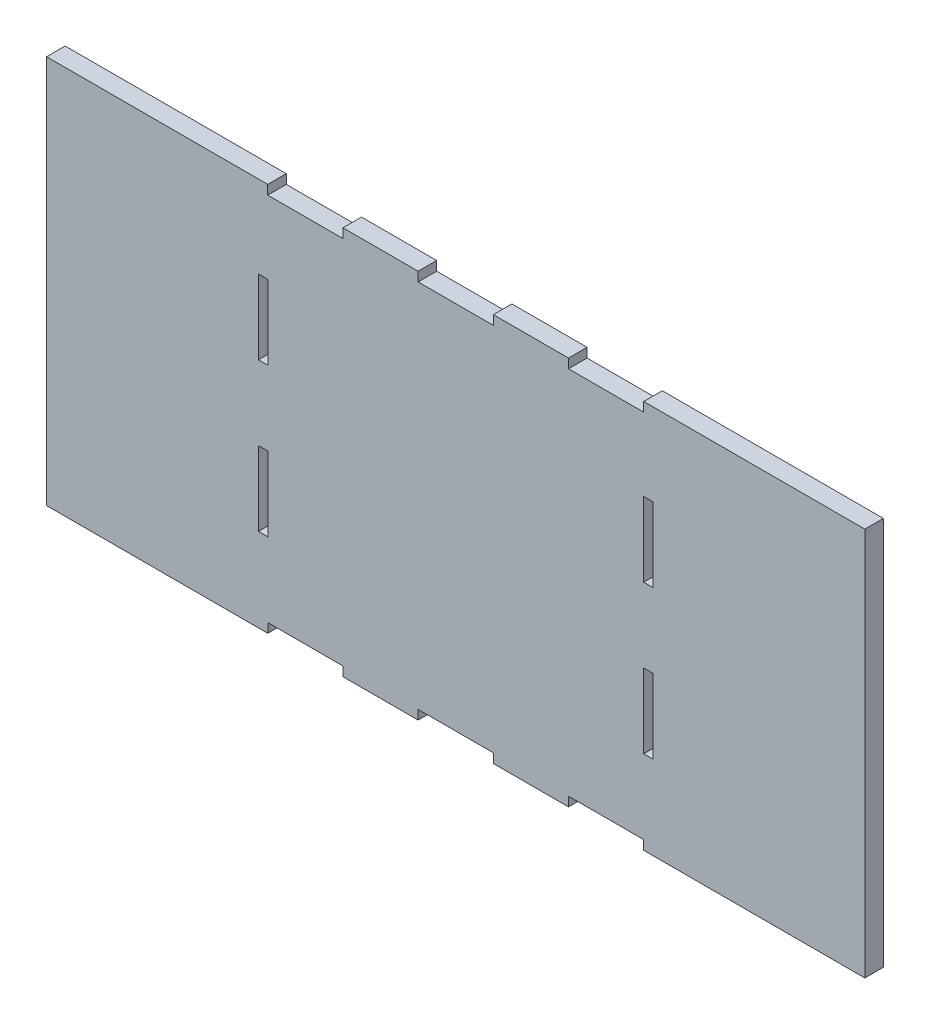
from build123d import *

# Parameters (mm, degrees)
BOSS_EXTRUDE1_DEPTH = 20.32
SKETCH2_W           = 10.166490401
SKETCH2_H           = 81.316938585
SKETCH2_W_2         = 10.166490402
SKETCH2_H_2         = 81.316938584
SKETCH2_W_3         = 82.271298803
SKETCH2_H_3         = 10.16
CUT_EXTRUDE2_DEPTH  = 137.414
CUT_EXTRUDE3_DEPTH  = 1426.288377921
SKETCH5_W           = 82.296
SKETCH5_H           = 10.16
CUT_EXTRUDE4_DEPTH  = 1408.889980636
CUT_EXTRUDE5_DEPTH  = 1408.889980636
SKETCH7_W           = 370.520147136
SKETCH7_H           = 597.78628448
SKETCH7_W_2         = 231.394598612
SKETCH7_H_2         = 493.59842382
CUT_EXTRUDE6_DEPTH  = 25.4


with BuildPart() as part:
    # Sketch1 → Boss-Extrude1 (new body)
    with BuildSketch(Plane.XY):
        with BuildLine():
            Line((0, 0), (1345.447057269, 0))
            Line((1345.447057269, 0), (1156.937235756, -454.288839135))
            add(Edge.make_bspline(
                [(1156.937235756, -454.288839135), (1155.965204773, -456.631331547), (1154.630956054, -458.816896883), (1152.225947859, -461.69350105), (1151.355065983, -462.590813772), (1149.473312624, -464.260936999), (1148.45987476, -465.033112958), (1146.360299176, -466.401155283), (1145.26635201, -467.004685932), (1142.990856866, -468.052074807), (1141.798989191, -468.498505895), (1138.174492983, -469.560599459), (1135.699262078, -469.911644948), (1133.16419506, -469.9)],
                knots=[0, 0, 0, 0, 0.25, 0.25, 0.375, 0.375, 0.5, 0.5, 0.625, 0.625, 0.75, 0.75, 1, 1, 1, 1], degree=3))
            Line((1133.16419506, -469.9), (212.282862208, -469.9))
            add(Edge.make_bspline(
                [(188.509821513, -454.288839135), (189.481852496, -456.631331547), (190.816101215, -458.816896883), (193.22110941, -461.69350105), (194.091991286, -462.590813772), (195.973744645, -464.260936999), (196.987182509, -465.033112958), (199.086758093, -466.401155283), (200.180705259, -467.004685932), (202.456200403, -468.052074807), (203.648068078, -468.498505895), (207.272564286, -469.560599459), (209.747795191, -469.911644948), (212.282862208, -469.9)],
                knots=[0, 0, 0, 0, 0.25, 0.25, 0.375, 0.375, 0.5, 0.5, 0.625, 0.625, 0.75, 0.75, 1, 1, 1, 1], degree=3))
            Line((188.509821513, -454.288839135), (0, 0))
        make_face()
    extrude(amount=BOSS_EXTRUDE1_DEPTH)

    # Sketch2 → Cut-Extrude2 (cut)
    with BuildSketch(Plane.XY.offset(20.32)):
        with Locations((461.924984631, -337.764592123)):
            Rectangle(SKETCH2_W, SKETCH2_H)
        with Locations((883.522072638, -337.764592123)):
            Rectangle(SKETCH2_W_2, SKETCH2_H)
        with Locations((883.522072638, -175.130714953)):
            Rectangle(SKETCH2_W_2, SKETCH2_H_2)
        with Locations((461.924984631, -175.130714953)):
            Rectangle(SKETCH2_W, SKETCH2_H_2)
        with Locations((837.303178036, -464.82)):
            Rectangle(SKETCH2_W_3, SKETCH2_H_3)
        with Locations((672.723528635, -464.82)):
            Rectangle(SKETCH2_W_3, SKETCH2_H_3)
        with Locations((508.143879233, -464.82)):
            Rectangle(SKETCH2_W_3, SKETCH2_H_3)
    extrude(amount=-CUT_EXTRUDE2_DEPTH, mode=Mode.SUBTRACT)

    # Sketch4 → Cut-Extrude3 (cut, through all)
    with BuildSketch(Plane.XY.offset(20.32)):
        Polygon((0, 0), (1345.447057269, 0), (1327.002268746, -44.45), (18.444788523, -44.45), align=None)
    extrude(amount=-CUT_EXTRUDE3_DEPTH, mode=Mode.SUBTRACT)

    # Sketch5 → Cut-Extrude4 (cut, through all)
    with BuildSketch(Plane.XY.offset(20.32)):
        with Locations((508.131528634, -49.53)):
            Rectangle(SKETCH5_W, SKETCH5_H)
        with Locations((672.723528634, -49.53)):
            Rectangle(SKETCH5_W, SKETCH5_H)
        with Locations((837.315528634, -49.53)):
            Rectangle(SKETCH5_W, SKETCH5_H)
    extrude(amount=-CUT_EXTRUDE4_DEPTH, mode=Mode.SUBTRACT)

    # Sketch6 → Cut-Extrude5 (cut, through all)
    with BuildSketch(Plane.XY.offset(20.32)):
        Polygon((192.807539001, -448.077869782), (224.982862208, -469.9), (232.080223429, -549.766419732), (-59.510742861, -242.335130221), (-120.238907144, 37.382474964), (56.544788523, -44.45), (56.544788523, -119.698975594), align=None)
        Polygon((1120.46419506, -469.9), (1113.36683384, -549.766419732), (1404.95780013, -242.335130221), (1465.685964413, 37.382474964), (1288.902268746, -44.45), (1288.902268746, -119.698975594), (1152.639518267, -448.077869782), align=None)
    extrude(amount=-CUT_EXTRUDE5_DEPTH, mode=Mode.SUBTRACT)

    # Sketch7 → Cut-Extrude6 (cut)
    with BuildSketch(Plane.XY.offset(20.32)):
        with Locations((39.72278864, -171.00685776)):
            Rectangle(SKETCH7_W, SKETCH7_H)
        with Locations((1236.161494366, -223.10078809)):
            Rectangle(SKETCH7_W_2, SKETCH7_H_2)
    extrude(amount=-CUT_EXTRUDE6_DEPTH, mode=Mode.SUBTRACT)


solid = part.part
